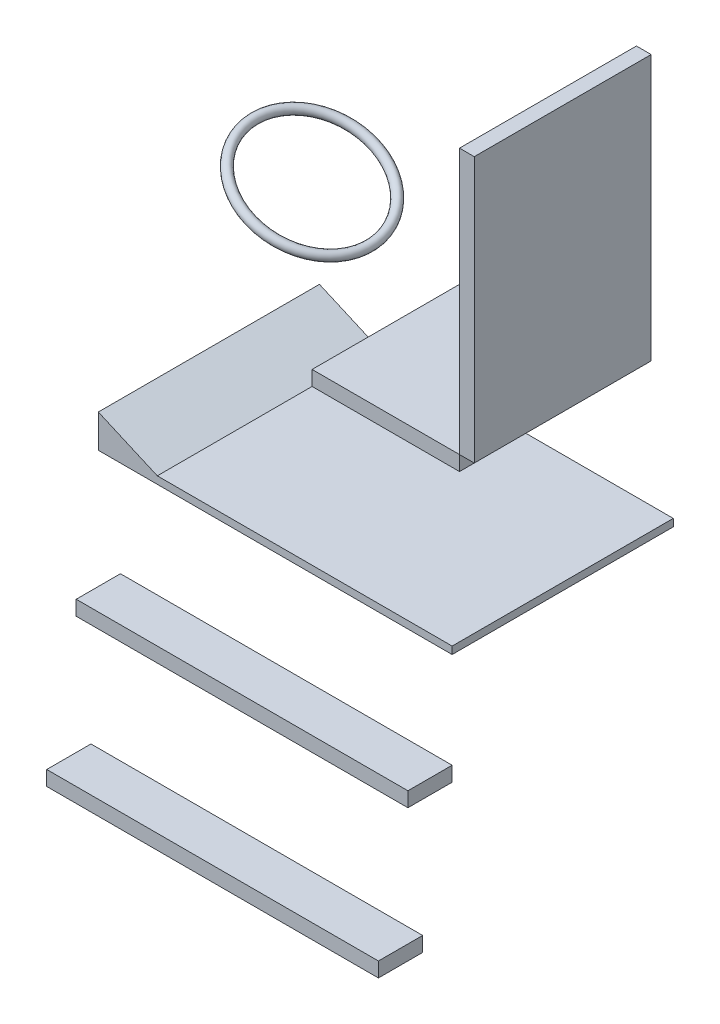
from build123d import *

# Parameters (mm, degrees)
STEP_2_2_W           = 1143
STEP_2_2_H           = 152.4
STEP_2_DEPTH         = 50.8
SKETCH4_W            = 1143
SKETCH4_H            = 152.4
STEP_1_DEPTH         = 50.8
SKETCH5_W            = 508
SKETCH5_H            = 609.6
SEAT_BOTTOM_DEPTH    = 50.8
SEAT_BACK_DEPTH      = 304.8
SEAT_BACK_DEPTH_BACK = 304.8
SKETCH6_W            = 50.8
SKETCH6_H            = 914.4
FLOOR_2_DEPTH        = 381
FLOOR_2_DEPTH_BACK   = 381
SKETCH12_R           = 15.875


with BuildPart() as part:
    # Step 2 2 → Step-2 (new body)
    with BuildSketch(Plane(origin=(0, 914.4, 0), x_dir=(1, 0, 0), z_dir=(0, 1, 0))):
        with Locations((647.7, -76.2)):
            Rectangle(STEP_2_2_W, STEP_2_2_H)
    extrude(amount=-STEP_2_DEPTH)


with BuildPart() as body_2:
    # Sketch4 → Step-1 (new body)
    with BuildSketch(Plane(origin=(0, 457.2, 0), x_dir=(1, 0, 0), z_dir=(0, 1, 0))):
        with Locations((647.7, -177.8)):
            Rectangle(SKETCH4_W, SKETCH4_H)
    extrude(amount=-STEP_1_DEPTH)


with BuildPart() as body_3:
    # Sketch5 → Seat-Bottom (new body)
    with BuildSketch(Plane(origin=(0, 1778, 0), x_dir=(1, 0, 0), z_dir=(0, 1, 0))):
        with Locations((914.4, 381)):
            Rectangle(SKETCH5_W, SKETCH5_H)
    extrude(amount=-SEAT_BOTTOM_DEPTH)


with BuildPart() as body_4:
    # Sketch6 → Seat-Back (new, two sides: drawn at the far end of the back side and taken through both)
    with BuildSketch(Plane.XY.offset(-381).offset(-SEAT_BACK_DEPTH_BACK)):
        with Locations((1193.8, 2235.2)):
            Rectangle(SKETCH6_W, SKETCH6_H)
    extrude(amount=SEAT_BACK_DEPTH + SEAT_BACK_DEPTH_BACK)


with BuildPart() as body_5:
    # Sketch7 → Floor 2 (new, two sides: drawn at the far end of the back side and taken through both)
    with BuildSketch(Plane.XY.offset(-381).offset(-FLOOR_2_DEPTH_BACK)):
        Polygon((0, 1358.9), (203.2, 1270), (1219.2, 1270), (1219.2, 1244.6), (0, 1244.6), align=None)
    extrude(amount=FLOOR_2_DEPTH + FLOOR_2_DEPTH_BACK)


with BuildPart() as body_6:
    # Sweep1: sweep along a path in Wheel Center
    with BuildLine(Plane(origin=(841.813517207, 1805.274913428, 0), x_dir=(0, 0, 1), z_dir=(-0.42261826174069383, -0.9063077870366526, 0))) as sweep1_path:
        CenterArc((-381, 536.725192411), 217.4875, 0, 360)
    # Sketch12 → Sweep1 (sweep)
    with BuildSketch(Plane.XY.offset(-381)):
        with Locations((158.264680993, 2124.018970477)):
            Circle(SKETCH12_R)
    sweep(path=sweep1_path.line)


solid = Compound([part.part, body_2.part, body_3.part, body_4.part, body_5.part, body_6.part])
